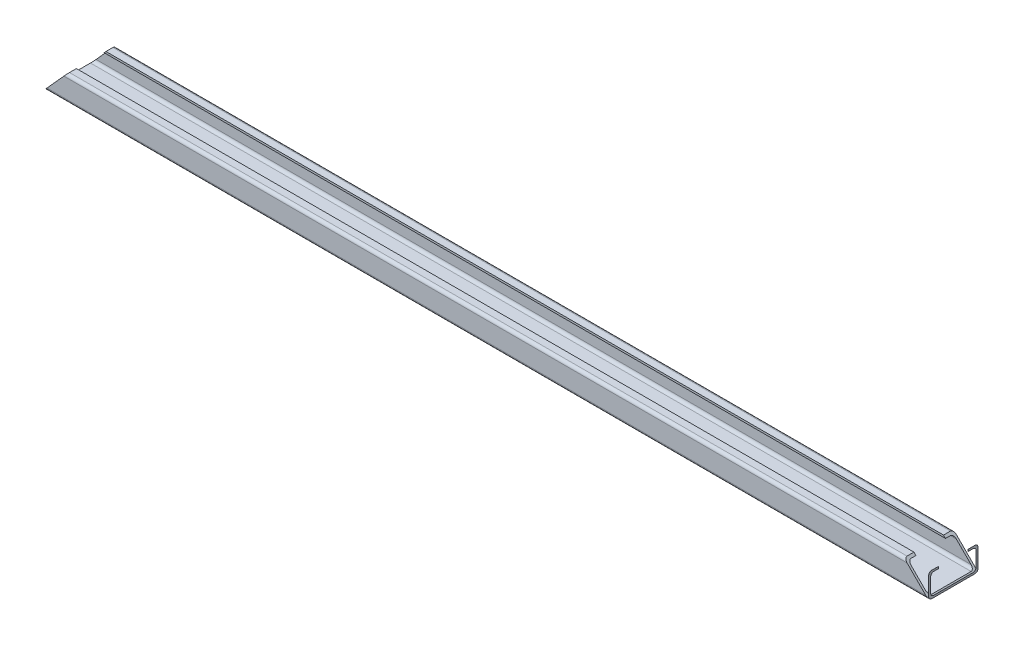
from build123d import *

# Parameters (mm, degrees)
RESSALTO_EXTRUS_O1_DEPTH = 1800
FILETE1_R                = 6
CORTE_EXTRUS_O1_DEPTH    = 50
CORTE_EXTRUS_O2_DEPTH    = 50


with BuildPart() as part:
    # Esboço1 → Ressalto-extrusão1 (new body)
    with BuildSketch(Plane(origin=(0, 0, 0), x_dir=(0, 0, -1), z_dir=(1, 0, 0))):
        Polygon((-46, 21), (-46, -21), (46, -21), (46, 21), (30, 21), (30, 25), (50, 25), (50, -25), (-50, -25), (-50, 25), (-30, 25), (-30, 21), align=None)
    extrude(amount=RESSALTO_EXTRUS_O1_DEPTH)

    # Filete1
    filete1_edges = [part.edges().sort_by_distance(p)[0] for p in [
        (900, -25, -50),
        (900, -25, 50),
        (900, 25, 50),
        (900, 21, 46),
        (900, -21, 46),
        (900, -21, -46),
        (900, 21, -46),
        (900, 25, -50),
    ]]
    fillet(filete1_edges, radius=FILETE1_R)

    # Esboço3 → Corte-extrusão1 (cut, symmetric)
    with BuildSketch(Plane.XY):
        Polygon((0, -25), (184.767559257, 159.767559257), (-208.615442636, 104.939092506), align=None)
        Polygon((1800, -25), (1477.707280818, 297.292719182), (1799.383443157, 297.292719182), align=None)
    extrude(amount=CORTE_EXTRUS_O1_DEPTH, both=True, mode=Mode.SUBTRACT)


with BuildPart() as corte_extrus_o1_piece_1:
    # of the separate pieces the step leaves, piece 1, a body of its own (corte_extrus_o1_pieces)
    add(part.part.solids().sort_by_distance((40, 15, 46))[0])

    # Esboço4 → Corte-extrusão2 (cut, symmetric)
    with BuildSketch(Plane.XY):
        Polygon((50, 25), (-16.235639867, -48.562130564), (-42.129730134, -17.715767118), align=None)
    extrude(amount=CORTE_EXTRUS_O2_DEPTH, both=True, mode=Mode.SUBTRACT)


with BuildPart() as corte_extrus_o1_piece_2:
    # of the separate pieces the step leaves, piece 2, a body of its own (corte_extrus_o1_pieces)
    add(part.part.solids().sort_by_distance((1800, 15, 46))[0])


solid = Compound([corte_extrus_o1_piece_1.part, corte_extrus_o1_piece_2.part])
